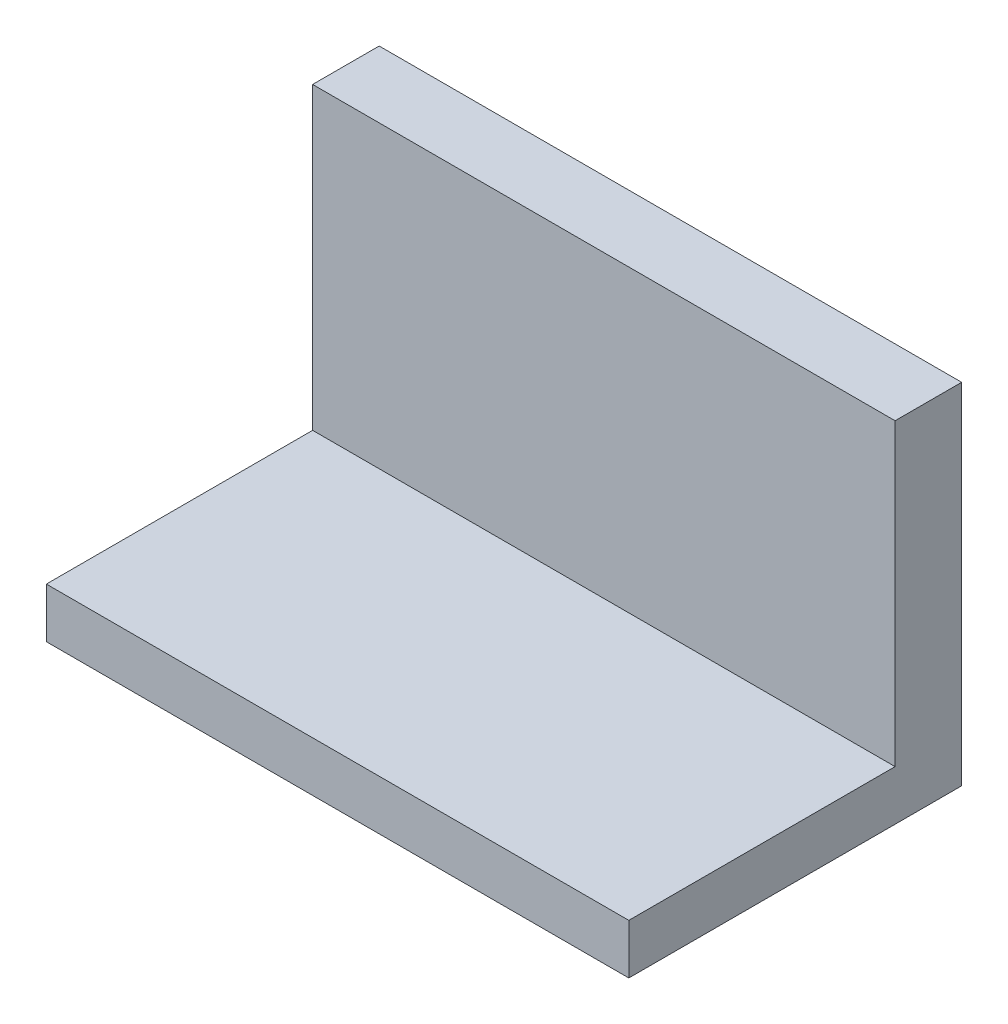
from build123d import *

# Parameters (mm, degrees)
SKETCH1_W           = 35
SKETCH1_H           = 20
BOSS_EXTRUDE1_DEPTH = 3
SKETCH1_3_W         = 35
SKETCH1_3_H         = 4
BOSS_EXTRUDE2_DEPTH = 21


with BuildPart() as part:
    # Sketch1 → Boss-Extrude1 (new body)
    with BuildSketch(Plane(origin=(0, 0, 0), x_dir=(1, 0, 0), z_dir=(0, 1, 0))):
        Rectangle(SKETCH1_W, SKETCH1_H)
    extrude(amount=BOSS_EXTRUDE1_DEPTH)

    # Sketch1<3> → Boss-Extrude2 (add)
    with BuildSketch(Plane(origin=(0, 0, 0), x_dir=(1, 0, 0), z_dir=(0, 1, 0))):
        with Locations((0, 8)):
            Rectangle(SKETCH1_3_W, SKETCH1_3_H)
    extrude(amount=BOSS_EXTRUDE2_DEPTH)


solid = part.part
